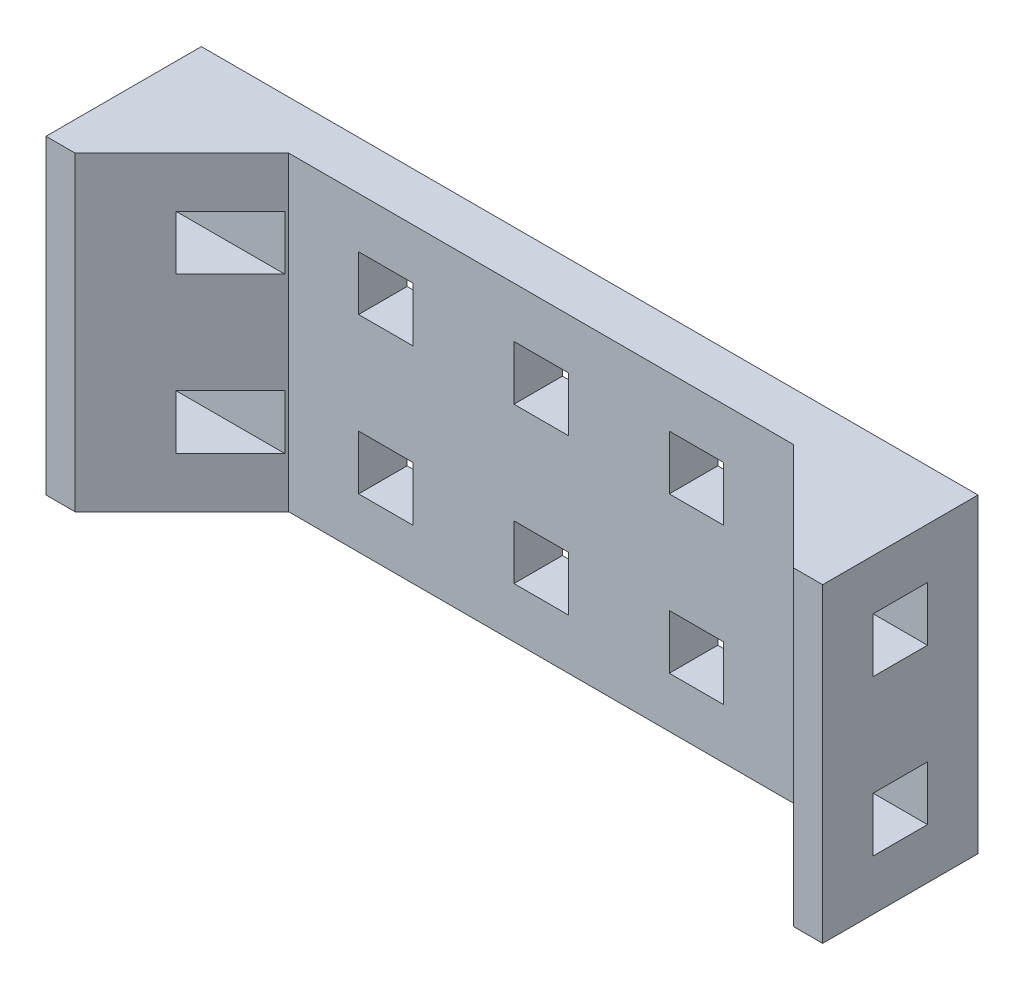
from build123d import *

# Parameters (mm, degrees)
RESSALTO_EXTRUS_O1_DEPTH  = 16
ESBO_O2_W                 = 2.8
ESBO_O2_H                 = 2.8
CORTE_EXTRUS_O1_DEPTH     = 54.103672189
ESBO_O4_W                 = 2.8
ESBO_O4_H                 = 2.8
CORTE_EXTRUS_O2_DEPTH     = 31.186917696
CORPO_MOVER_COPIAR1_ANGLE = 90
ESBO_O6_W                 = 30
ESBO_O6_H                 = 16
CORTE_EXTRUS_O3_DEPTH     = 29.861739379
ESBO_O7_W                 = 25.221413321
ESBO_O7_H                 = 12.57615678
RESSALTO_EXTRUS_O2_DEPTH  = 2.5
ESBO_O8_W                 = 2.8
ESBO_O8_H                 = 2.8
CORTE_EXTRUS_O4_DEPTH     = 29.271009886


with BuildPart() as part:
    # Esboço1 → Ressalto-extrusão1 (new body)
    with BuildSketch(Plane.XY):
        Polygon((-25, 0), (25, 0), (25, 8), (23.5, 8), (18, 2.5), (-18, 2.5), (-23.5, 8), (-25, 8), align=None)
    extrude(amount=RESSALTO_EXTRUS_O1_DEPTH)

    # Esboço2 → Corte-extrusão1 (cut, through all)
    with BuildSketch(Plane(origin=(25, 0, 0), x_dir=(0, 0, -1), z_dir=(1, 0, 0))):
        with Locations((-4, 4)):
            Rectangle(ESBO_O2_W, ESBO_O2_H)
        with Locations((-12, 4)):
            Rectangle(ESBO_O2_W, ESBO_O2_H)
    extrude(amount=-CORTE_EXTRUS_O1_DEPTH, mode=Mode.SUBTRACT)

    # Esboço4 → Corte-extrusão2 (cut, through all)
    with BuildSketch(Plane(origin=(0, 2.5, 0), x_dir=(1, 0, 0), z_dir=(0, 1, 0))):
        with Locations((-16, -4)):
            Rectangle(ESBO_O4_W, ESBO_O4_H)
        with Locations((-8, -4)):
            Rectangle(ESBO_O4_W, ESBO_O4_H)
        with Locations((0, -4)):
            Rectangle(ESBO_O4_W, ESBO_O4_H)
        with Locations((8, -4)):
            Rectangle(ESBO_O4_W, ESBO_O4_H)
        with Locations((16, -4)):
            Rectangle(ESBO_O4_W, ESBO_O4_H)
        with Locations((-8, -12)):
            Rectangle(ESBO_O4_W, ESBO_O4_H)
        with Locations((0, -12)):
            Rectangle(ESBO_O4_W, ESBO_O4_H)
        with Locations((8, -12)):
            Rectangle(ESBO_O4_W, ESBO_O4_H)
        with Locations((16, -12)):
            Rectangle(ESBO_O4_W, ESBO_O4_H)
        with Locations((-16, -12)):
            Rectangle(ESBO_O4_W, ESBO_O4_H)
    extrude(amount=-CORTE_EXTRUS_O2_DEPTH, mode=Mode.SUBTRACT)


with BuildPart() as part_1:
    # Corpo-Mover/Copiar1: moved
    add(part.part.rotate(Axis((0, 4, 8), (1, 0, 0)), CORPO_MOVER_COPIAR1_ANGLE))

    # Esboço6 → Corte-extrusão3 (cut, through all)
    with BuildSketch(Plane(origin=(0, 0, 4), x_dir=(-1, 0, 0), z_dir=(0, 0, -1))):
        with Locations((-10, 4)):
            Rectangle(ESBO_O6_W, ESBO_O6_H)
    extrude(amount=-CORTE_EXTRUS_O3_DEPTH, mode=Mode.SUBTRACT)

    # Espelhar3: part across plane


with BuildPart() as part_2:
    add(part_1.part)
    add(part_1.part.mirror(Plane(origin=(-5, -4, 12), x_dir=(0, 0, 1), z_dir=(-1, 0, 0))))

    # Esboço7 → Ressalto-extrusão2 (add, through all)
    with BuildSketch(Plane.XY.offset(6.5)):
        with Locations((-4.971284079, 3.626460754)):
            Rectangle(ESBO_O7_W, ESBO_O7_H)
    extrude(amount=-RESSALTO_EXTRUS_O2_DEPTH)

    # Esboço8 → Corte-extrusão4 (cut, through all)
    with BuildSketch(Plane.XY.offset(6.5)):
        with Locations((-5, 8)):
            Rectangle(ESBO_O8_W, ESBO_O8_H)
        with Locations((-13, 8)):
            Rectangle(ESBO_O8_W, ESBO_O8_H)
        with Locations((3, 8)):
            Rectangle(ESBO_O8_W, ESBO_O8_H)
        with Locations((-5, 0)):
            Rectangle(ESBO_O8_W, ESBO_O8_H)
        with Locations((3, 0)):
            Rectangle(ESBO_O8_W, ESBO_O8_H)
        with Locations((-13, 0)):
            Rectangle(ESBO_O8_W, ESBO_O8_H)
    extrude(amount=-CORTE_EXTRUS_O4_DEPTH, mode=Mode.SUBTRACT)


solid = part_2.part
